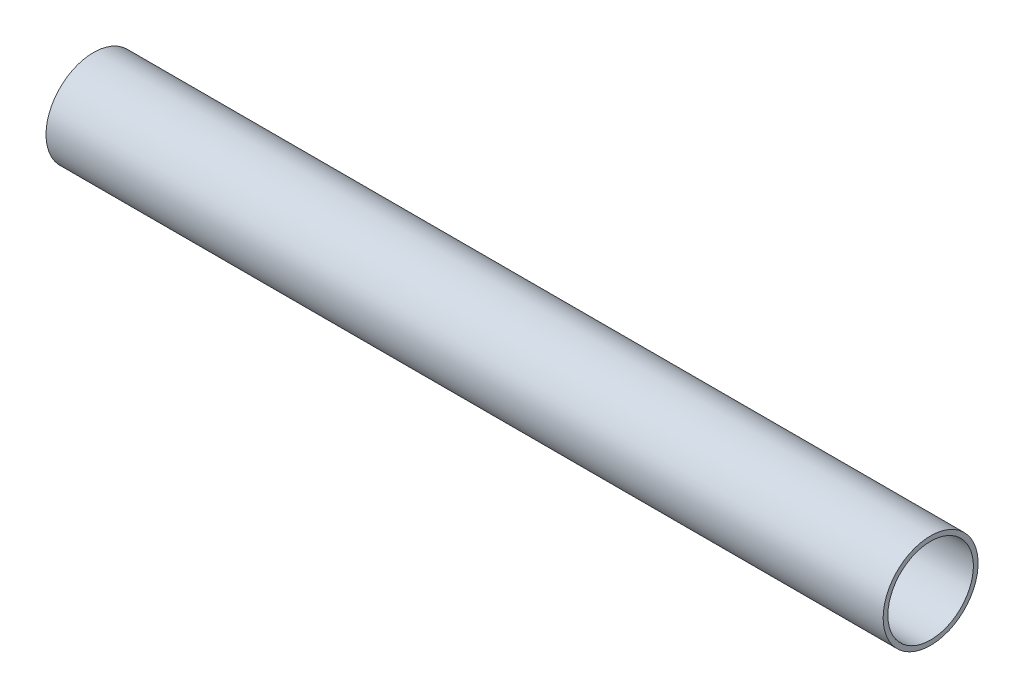
from build123d import *

# Parameters (mm, degrees)
SKETCH1_R           = 15.875
SKETCH1_R_2         = 14.2875
EXTRUDE_THIN1_DEPTH = 139.95575006


with BuildPart() as part:
    # Sketch1 → Extrude-Thin1 (new, symmetric)
    with BuildSketch(Plane(origin=(0, 0, 0), x_dir=(0, 0, -1), z_dir=(1, 0, 0))):
        Circle(SKETCH1_R)
        Circle(SKETCH1_R_2, mode=Mode.SUBTRACT)
    extrude(amount=EXTRUDE_THIN1_DEPTH, both=True)


solid = part.part
